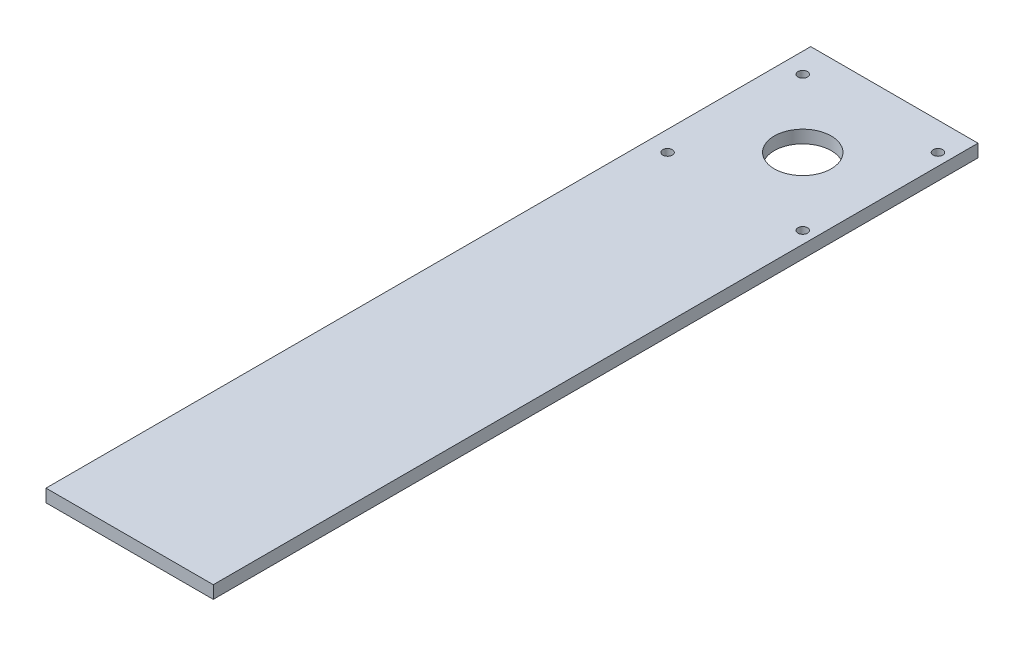
from build123d import *

# Parameters (mm, degrees)
SKETCH1_W           = 105
SKETCH1_H           = 480
SKETCH1_R           = 17.861575789
SKETCH1_R_2         = 3
BOSS_EXTRUDE1_DEPTH = 8


with BuildPart() as part:
    # Sketch1 → Boss-Extrude1 (new body)
    with BuildSketch(Plane(origin=(0, 0, 0), x_dir=(1, 0, 0), z_dir=(0, 1, 0))):
        with Locations((-2.5, 0)):
            Rectangle(SKETCH1_W, SKETCH1_H)
        with Locations(Location((0, 180, 0), (0, 0, 270))):
            Circle(SKETCH1_R, mode=Mode.SUBTRACT)
        with Locations(Location((-42.426406871, 137.573593129, 0), (0, 0, 270))):
            Circle(SKETCH1_R_2, mode=Mode.SUBTRACT)
        with Locations(Location((-42.426406871, 222.426406871, 0), (0, 0, 270))):
            Circle(SKETCH1_R_2, mode=Mode.SUBTRACT)
        with Locations(Location((42.426406871, 222.426406871, 0), (0, 0, 270))):
            Circle(SKETCH1_R_2, mode=Mode.SUBTRACT)
        with Locations(Location((42.426406871, 137.573593129, 0), (0, 0, 270))):
            Circle(SKETCH1_R_2, mode=Mode.SUBTRACT)
    extrude(amount=BOSS_EXTRUDE1_DEPTH)


solid = part.part
